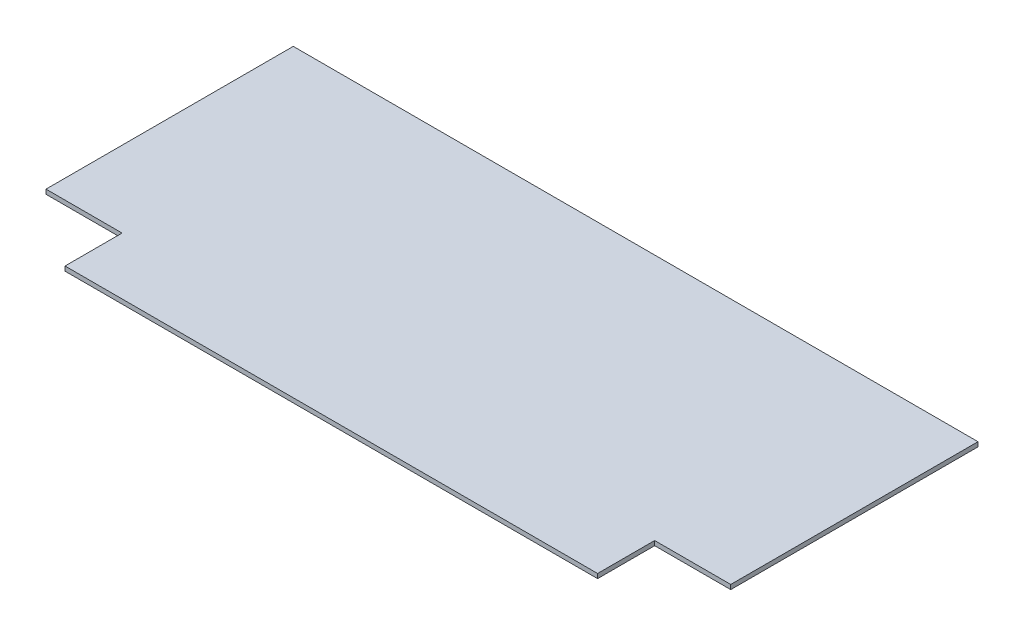
from build123d import *

# Parameters (mm, degrees)
SKETCH1_W           = 457.2
SKETCH1_H           = 203.2
BOSS_EXTRUDE1_DEPTH = 3
SKETCH2_W           = 50.8
SKETCH2_H           = 38.1
CUT_EXTRUDE1_DEPTH  = 251.178975935


with BuildPart() as part:
    # Sketch1 → Boss-Extrude1 (new body)
    with BuildSketch(Plane(origin=(0, 0, 0), x_dir=(1, 0, 0), z_dir=(0, 1, 0))):
        Rectangle(SKETCH1_W, SKETCH1_H)
    extrude(amount=BOSS_EXTRUDE1_DEPTH)

    # Sketch2 → Cut-Extrude1 (cut, through all)
    with BuildSketch(Plane(origin=(0, 3, 0), x_dir=(1, 0, 0), z_dir=(0, 1, 0))):
        with Locations((-203.2, -82.55)):
            Rectangle(SKETCH2_W, SKETCH2_H)
        with Locations((203.2, -82.55)):
            Rectangle(SKETCH2_W, SKETCH2_H)
    extrude(amount=-CUT_EXTRUDE1_DEPTH, mode=Mode.SUBTRACT)


solid = part.part
